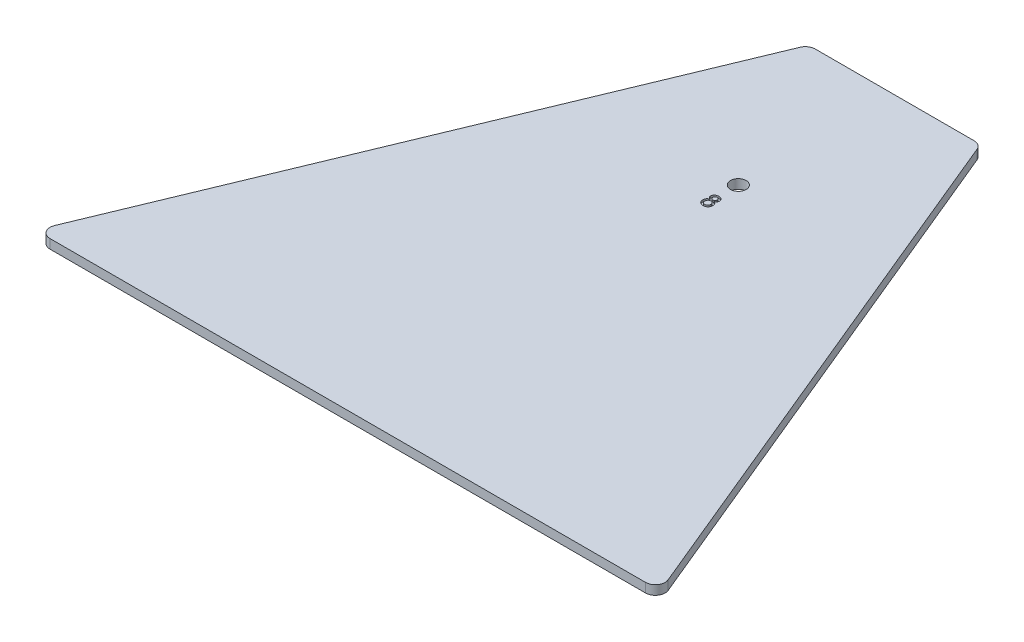
from build123d import *

# Parameters (mm, degrees)
BOSS_EXTRUDE1_DEPTH = 5.9944
SKETCH2_R           = 5.08
CUT_EXTRUDE1_DEPTH  = 412.816809185
CUT_EXTRUDE2_DEPTH  = 1.27
FILLET1_R           = 6.35


with BuildPart() as part:
    # Sketch1 → Boss-Extrude1 (new body)
    with BuildSketch(Plane(origin=(0, 0, 0), x_dir=(1, 0, 0), z_dir=(0, 1, 0))):
        Polygon((-60.325, 0), (51.435, 0), (198.72934278, -355.6), (-207.61934278, -355.6), align=None)
    extrude(amount=BOSS_EXTRUDE1_DEPTH)

    # Sketch2 → Cut-Extrude1 (cut, through all)
    with BuildSketch(Plane(origin=(0, 5.9944, 0), x_dir=(1, 0, 0), z_dir=(0, 1, 0))):
        with Locations(Location((-4.445, -101.6, 0), (0, 0, 270))):
            Circle(SKETCH2_R)
    extrude(amount=-CUT_EXTRUDE1_DEPTH, mode=Mode.SUBTRACT)

    # Sketch3 → Cut-Extrude2 (cut)
    with BuildSketch(Plane(origin=(0, 5.9944, 0), x_dir=(1, 0, 0), z_dir=(0, 1, 0))):
        with BuildLine():
            add(Edge.make_bspline(
                [(-5.640294118, -118.844607843), (-5.768281461, -118.7980584), (-6.012903349, -118.709088566), (-6.344808892, -118.528644016), (-6.628148212, -118.321295156), (-6.859224633, -118.080893307), (-7.042120778, -117.812676631), (-7.164700527, -117.51094663), (-7.246991297, -117.183653612), (-7.254869453, -116.9546664), (-7.258921569, -116.836887255)],
                knots=[0, 0, 0, 0, 1.173413012, 2.242741344, 3.246972854, 4.190159209, 5.106157181, 6.028734337, 6.986083187, 8, 8, 8, 8], degree=3))
            add(Edge.make_bspline(
                [(-7.258921569, -116.836887255), (-7.256653552, -116.74543812), (-7.252200886, -116.565901343), (-7.213482148, -116.303182669), (-7.152660448, -116.051861575), (-7.060728999, -115.816064709), (-6.94901075, -115.590943888), (-6.806603031, -115.383438523), (-6.644343219, -115.184183893), (-6.45490221, -115.003149717), (-6.246885977, -114.837793075), (-6.022041475, -114.69497982), (-5.7838008, -114.572137861), (-5.531145358, -114.473110122), (-5.264549685, -114.394868468), (-4.984496654, -114.338509959), (-4.689484701, -114.308439202), (-4.488640248, -114.302856801), (-4.385857843, -114.3)],
                knots=[0, 0, 0, 0, 1.020607516, 2.003699488, 2.959093155, 3.90154348, 4.82383827, 5.758924752, 6.705354677, 7.688583181, 8.678343028, 9.668238486, 10.65793052, 11.666964273, 12.693473199, 13.756849753, 14.852065001, 16, 16, 16, 16], degree=3))
            add(Edge.make_bspline(
                [(-4.385857843, -114.3), (-4.204545978, -114.307182695), (-3.846812052, -114.321354376), (-3.325593417, -114.452611845), (-2.831953616, -114.659661213), (-2.448510098, -114.897294215), (-2.168676808, -115.124039422), (-1.984603203, -115.31762303), (-1.82878598, -115.529848563), (-1.699174378, -115.761340468), (-1.604276743, -116.013935686), (-1.53070498, -116.282355633), (-1.491818503, -116.571186294), (-1.485111623, -116.769344483), (-1.481666667, -116.871127451)],
                knots=[0, 0, 0, 0, 1.49991019, 2.959369276, 4.423378123, 5.921390363, 6.678638349, 7.402202754, 8.127755887, 8.854987543, 9.592510724, 10.357767003, 11.156475192, 12, 12, 12, 12], degree=3))
            add(Edge.make_bspline(
                [(-1.481666667, -116.871127451), (-1.485981374, -116.986769655), (-1.494320954, -117.210285987), (-1.572283013, -117.531243569), (-1.696017648, -117.824461788), (-1.875697281, -118.087738493), (-2.102550457, -118.322461305), (-2.37847657, -118.530388471), (-2.705170536, -118.708248837), (-2.946454343, -118.79787135), (-3.072279412, -118.844607843)],
                knots=[0, 0, 0, 0, 1.014624892, 1.96109401, 2.884086684, 3.796937268, 4.744810514, 5.74041467, 6.821667794, 8, 8, 8, 8], degree=3))
            add(Edge.make_bspline(
                [(-3.072279412, -118.844607843), (-2.914859742, -118.900489884), (-2.611977915, -119.008009197), (-2.201301068, -119.233230072), (-1.85753283, -119.508365329), (-1.571190747, -119.822675989), (-1.3501441, -120.184044387), (-1.194321746, -120.588929683), (-1.099246075, -121.036791949), (-1.088702629, -121.349878452), (-1.083235294, -121.512230392)],
                knots=[0, 0, 0, 0, 1.112885226, 2.141236288, 3.106314107, 4.037297253, 4.963019108, 5.91395125, 6.9182732, 8, 8, 8, 8], degree=3))
            add(Edge.make_bspline(
                [(-1.083235294, -121.512230392), (-1.086318941, -121.625474405), (-1.092368202, -121.847627831), (-1.137118864, -122.172750949), (-1.207746531, -122.481606909), (-1.308423274, -122.77502823), (-1.438648283, -123.051876406), (-1.600417225, -123.312302358), (-1.786045911, -123.560068261), (-2.004820521, -123.784957815), (-2.242643145, -123.990398791), (-2.500313239, -124.167920217), (-2.770635203, -124.32272247), (-3.061103925, -124.443446772), (-3.365060773, -124.540441866), (-3.686334259, -124.607785027), (-4.022388276, -124.65413566), (-4.252883136, -124.657501283), (-4.370294118, -124.659215686)],
                knots=[0, 0, 0, 0, 1.064292101, 2.08784667, 3.079199066, 4.038508011, 4.998411814, 5.948603018, 6.916206708, 7.902700801, 8.891891554, 9.865962993, 10.839887915, 11.814545202, 12.81711046, 13.834885875, 14.897119988, 16, 16, 16, 16], degree=3))
            add(Edge.make_bspline(
                [(-4.370294118, -124.659215686), (-4.530450496, -124.655055295), (-4.842398953, -124.646951791), (-5.293729483, -124.565960727), (-5.71503222, -124.441015444), (-6.099384044, -124.257093489), (-6.449092805, -124.034776245), (-6.756260599, -123.768991245), (-7.028635641, -123.471514872), (-7.2545707, -123.134254948), (-7.439104567, -122.764001399), (-7.56324669, -122.360000473), (-7.645470959, -121.927477068), (-7.653310887, -121.628844365), (-7.657352941, -121.474877451)],
                knots=[0, 0, 0, 0, 1.120474225, 2.182430745, 3.200631737, 4.18872885, 5.15617281, 6.094022942, 7.025121698, 7.972298329, 8.92766112, 9.911179284, 10.92306075, 12, 12, 12, 12], degree=3))
            add(Edge.make_bspline(
                [(-7.657352941, -121.474877451), (-7.652474419, -121.306189583), (-7.643139125, -120.983396938), (-7.542148126, -120.525386814), (-7.390372291, -120.11345735), (-7.162821914, -119.754925593), (-6.875293668, -119.443678395), (-6.520899225, -119.188042681), (-6.1048536, -118.982176757), (-5.79972148, -118.891818695), (-5.640294118, -118.844607843)],
                knots=[0, 0, 0, 0, 1.117326705, 2.138060355, 3.0968872, 4.015582046, 4.936209226, 5.891768515, 6.898477863, 8, 8, 8, 8], degree=3))
        make_face()
        with BuildLine():
            add(Edge.make_bspline(
                [(-5.864411765, -116.855563725), (-5.860924518, -116.958010868), (-5.854216871, -117.155065791), (-5.765784417, -117.432384032), (-5.640947106, -117.685224799), (-5.451456684, -117.896691957), (-5.226791082, -118.071851556), (-4.962683383, -118.194777943), (-4.670317297, -118.271397042), (-4.464171965, -118.279918431), (-4.357843137, -118.284313725)],
                knots=[0, 0, 0, 0, 1.049749877, 2.019171811, 2.969415362, 3.930571672, 4.912841927, 5.882263861, 6.9076813, 8, 8, 8, 8], degree=3))
            add(Edge.make_bspline(
                [(-4.357843137, -118.284313725), (-4.267190664, -118.280193467), (-4.087615794, -118.272031584), (-3.823719553, -118.203958648), (-3.574222101, -118.089196592), (-3.337369037, -117.939101774), (-3.129857845, -117.746660089), (-2.978959746, -117.504417071), (-2.889286093, -117.221730721), (-2.880680381, -117.020186607), (-2.876176471, -116.914705882)],
                knots=[0, 0, 0, 0, 0.963702045, 1.909012115, 2.877635224, 3.876069072, 4.883498001, 5.860766905, 6.880404623, 8, 8, 8, 8], degree=3))
            add(Edge.make_bspline(
                [(-2.876176471, -116.914705882), (-2.880320884, -116.806003587), (-2.888257178, -116.597845456), (-2.982975445, -116.307569109), (-3.13119673, -116.055199378), (-3.34173584, -115.85609348), (-3.578520019, -115.695862312), (-3.83314048, -115.57939674), (-4.099621151, -115.506701151), (-4.28164435, -115.49911732), (-4.373406863, -115.495294118)],
                knots=[0, 0, 0, 0, 1.127500904, 2.159094072, 3.142695739, 4.143230944, 5.146793142, 6.108626903, 7.046510837, 8, 8, 8, 8], degree=3))
            add(Edge.make_bspline(
                [(-4.373406863, -115.495294118), (-4.474474554, -115.500065785), (-4.670996862, -115.509344111), (-4.955160717, -115.582421103), (-5.212606095, -115.70863905), (-5.438689503, -115.879739544), (-5.62744998, -116.08395805), (-5.764312365, -116.319650961), (-5.848604785, -116.580214386), (-5.859074542, -116.762592094), (-5.864411765, -116.855563725)],
                knots=[0, 0, 0, 0, 1.078218644, 2.096555407, 3.107271322, 4.119806927, 5.107928669, 6.056056474, 7.009025814, 8, 8, 8, 8], degree=3))
        make_face(mode=Mode.SUBTRACT)
        with BuildLine():
            add(Edge.make_bspline(
                [(-6.262843137, -121.453088235), (-6.261298067, -121.532062003), (-6.258299158, -121.685346403), (-6.227977336, -121.907756099), (-6.187633061, -122.117531737), (-6.120192673, -122.310529782), (-6.039744497, -122.490957051), (-5.938476689, -122.65557316), (-5.82434678, -122.811352176), (-5.641910932, -122.988161746), (-5.395980801, -123.178617287), (-5.069204271, -123.342051313), (-4.722376449, -123.44821201), (-4.482077929, -123.45865686), (-4.360955882, -123.463921569)],
                knots=[0, 0, 0, 0, 0.915735869, 1.777400627, 2.601488155, 3.389611073, 4.143901115, 4.889298653, 5.628545054, 6.377725128, 7.829754517, 9.21892808, 10.59820559, 12, 12, 12, 12], degree=3))
            add(Edge.make_bspline(
                [(-4.360955882, -123.463921569), (-4.244070539, -123.45814149), (-4.011671439, -123.44664916), (-3.673723511, -123.347249825), (-3.351752928, -123.193652736), (-3.104787343, -123.014894989), (-2.92282109, -122.844840257), (-2.804586484, -122.695868496), (-2.699780546, -122.534741789), (-2.62065757, -122.353962845), (-2.552880219, -122.16115171), (-2.512632107, -121.951322958), (-2.482143549, -121.727898463), (-2.479246916, -121.573569079), (-2.477745098, -121.493553922)],
                knots=[0, 0, 0, 0, 1.37269116, 2.72927453, 4.110677498, 5.553914238, 6.296474074, 7.034302579, 7.786136671, 8.550941152, 9.350050124, 10.185625034, 11.059300983, 12, 12, 12, 12], degree=3))
            add(Edge.make_bspline(
                [(-2.477745098, -121.493553922), (-2.483630192, -121.352722772), (-2.495006597, -121.080483782), (-2.60268714, -120.693302545), (-2.770681208, -120.341906837), (-3.013921411, -120.042681729), (-3.300915016, -119.790113634), (-3.635707493, -119.611392315), (-4.00477824, -119.495591574), (-4.264597088, -119.485038711), (-4.398308824, -119.479607843)],
                knots=[0, 0, 0, 0, 1.083575586, 2.094646838, 3.074961835, 4.065731916, 5.047123519, 6.002911055, 6.972229185, 8, 8, 8, 8], degree=3))
            add(Edge.make_bspline(
                [(-4.398308824, -119.479607843), (-4.51307051, -119.48550344), (-4.741293091, -119.497227809), (-5.075791284, -119.595526955), (-5.391477394, -119.758351267), (-5.640183053, -119.936812163), (-5.819703541, -120.111248651), (-5.939709917, -120.259029867), (-6.040242629, -120.422270239), (-6.119512002, -120.601057575), (-6.187716213, -120.79166566), (-6.228262868, -120.999410109), (-6.258258414, -121.220834879), (-6.261284213, -121.374116104), (-6.262843137, -121.453088235)],
                knots=[0, 0, 0, 0, 1.356797633, 2.69821633, 4.088085986, 5.54754192, 6.303274427, 7.045712095, 7.79573256, 8.565314721, 9.357790869, 10.186565194, 11.065698936, 12, 12, 12, 12], degree=3))
        make_face(mode=Mode.SUBTRACT)
    extrude(amount=-CUT_EXTRUDE2_DEPTH, mode=Mode.SUBTRACT)

    # Fillet1
    fillet1_edges = [part.edges().sort_by_distance(p)[0] for p in [
        (198.72934278, 2.9972, 355.6),
        (-207.61934278, 2.9972, 355.6),
        (-60.325, 2.9972, 0),
        (51.435, 2.9972, 0),
    ]]
    fillet(fillet1_edges, radius=FILLET1_R)


solid = part.part
